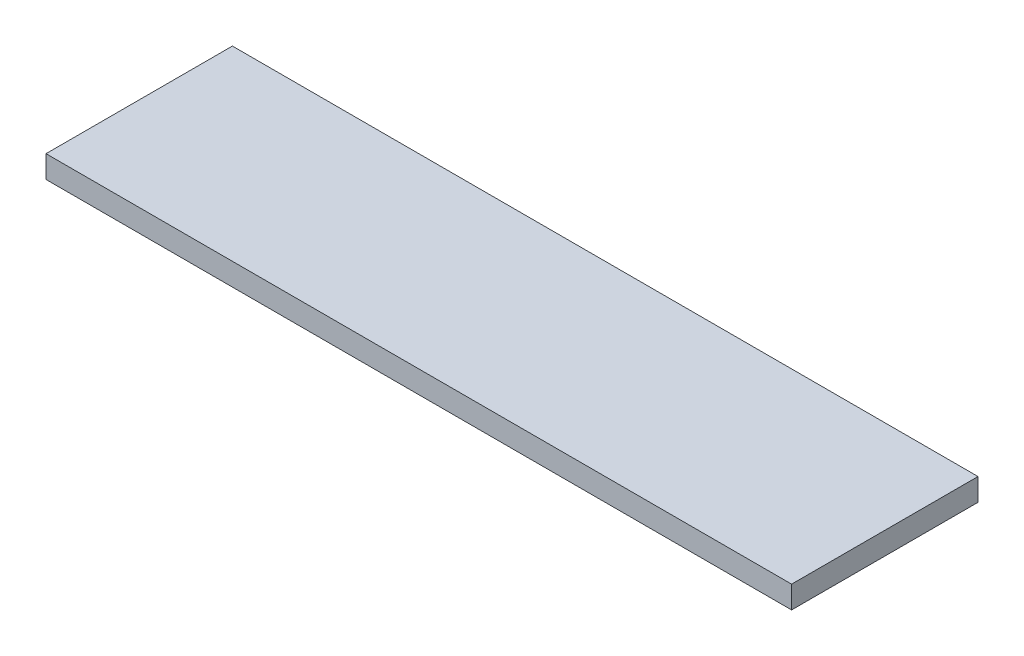
from build123d import *

# Parameters (mm, degrees)
SKETCH_1_W        = 200
SKETCH_1_H        = 50
EXTRUDE_337_DEPTH = 3


with BuildPart() as part:
    # ｽｹｯﾁ1 → Extrude 337 (new, symmetric)
    with BuildSketch(Plane(origin=(0, 0, 0), x_dir=(1, 0, 0), z_dir=(0, 1, 0))):
        Rectangle(SKETCH_1_W, SKETCH_1_H)
    extrude(amount=EXTRUDE_337_DEPTH, both=True)


solid = part.part
